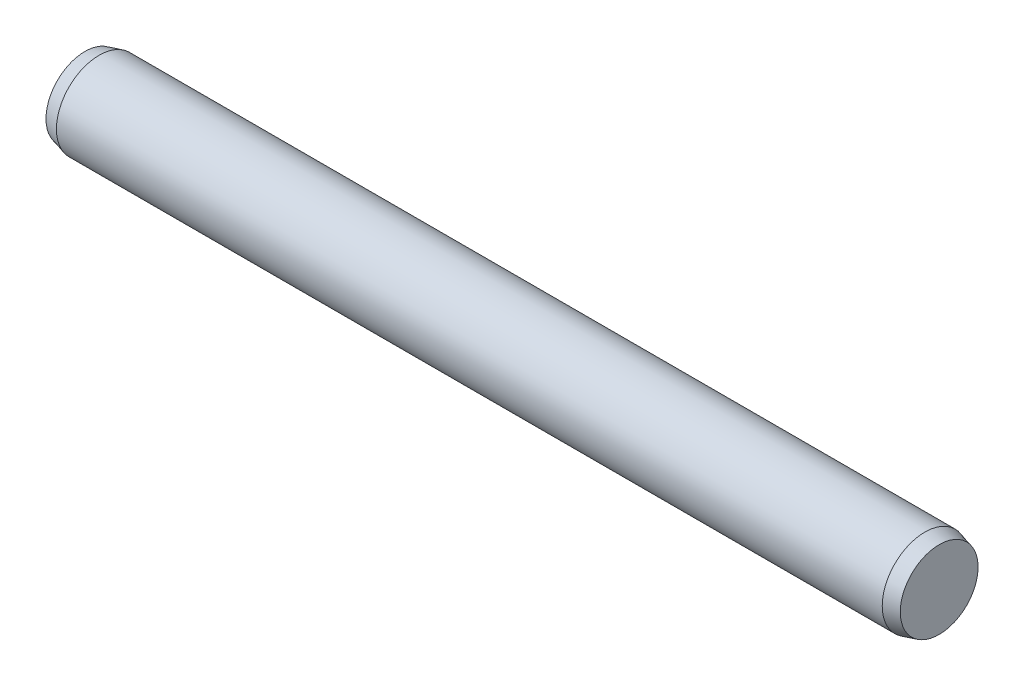
from build123d import *


with BuildPart() as part:
    # Sketch1 → Base-Revolve (revolve)
    with BuildSketch(Plane.XY, mode=Mode.PRIVATE) as base_revolve_sk:
        Polygon((0, 0), (30, 0), (30, 1.366025404), (29.5, 1.5), (0.5, 1.5), (0, 1.366025404), align=None)
    revolve(base_revolve_sk.sketch.rotate(Axis((-6.35, 0, 0), (1, 0, 0)), 90), axis=Axis((-6.35, 0, 0), (1, 0, 0)))


solid = part.part
